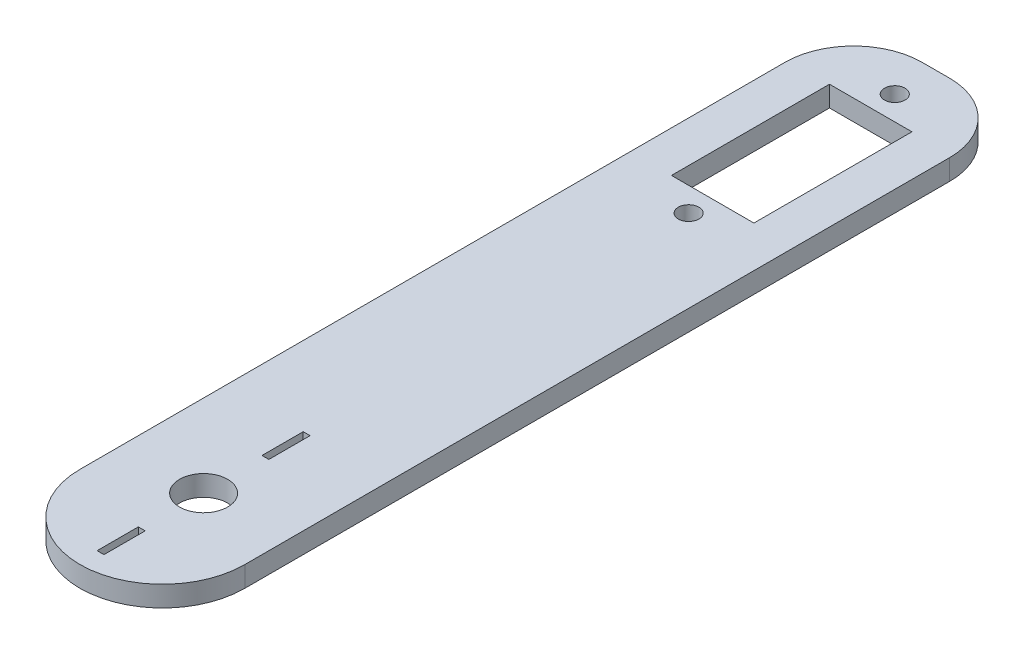
from build123d import *

# Parameters (mm, degrees)
ESBO_O4_R                = 3.5
ESBO_O4_R_2              = 1.5
RESSALTO_EXTRUS_O1_DEPTH = 3


with BuildPart() as part:
    # Esboço4 → Ressalto-extrusão1 (new body)
    with BuildSketch(Plane(origin=(0, 0, 0), x_dir=(1, 0, 0), z_dir=(0, 1, 0))):
        with BuildLine():
            Line((-11.987372598, 93.966613318), (-11.987372598, 71.466613318))
            Line((-11.987372598, 71.466613318), (-11.987372598, -8.633386682))
            ThreePointArc((-11.987372598, -8.633386682), (0.012627402, -20.633386682), (12.012627402, -8.633386682))
            Line((12.012627402, -8.633386682), (12.012627402, 71.466613318))
            Line((12.012627402, 71.466613318), (12.012627402, 93.966613318))
            ThreePointArc((12.012627402, 93.966613318), (9.083695214, 101.03768113), (2.012627402, 103.966613318))
            Line((2.012627402, 103.966613318), (0.012627402, 103.966613318))
            Line((0.012627402, 103.966613318), (-1.987372598, 103.966613318))
            ThreePointArc((-1.987372598, 103.966613318), (-9.05844041, 101.03768113), (-11.987372598, 93.966613318))
        make_face()
        Polygon((0.512627402, -17.633386682), (0.012627402, -17.633386682), (-0.487372598, -17.633386682), (-0.487372598, -11.633386682), (0.512627402, -11.633386682), align=None, mode=Mode.SUBTRACT)
        with Locations(Location((0.012627402, -2.633386682, 0), (0, 0, 270))):
            Circle(ESBO_O4_R, mode=Mode.SUBTRACT)
        Polygon((0.012627402, 12.366613318), (0.512627402, 12.366613318), (0.512627402, 6.366613318), (-0.487372598, 6.366613318), (-0.487372598, 12.366613318), align=None, mode=Mode.SUBTRACT)
        with Locations(Location((0.012627402, 67.966742295, 0), (0, 0, 270))):
            Circle(ESBO_O4_R_2, mode=Mode.SUBTRACT)
        Polygon((6.012627402, 94.466613318), (6.012627402, 71.466613318), (2.487372598, 71.466613318), (-2.487372598, 71.466613318), (-5.987372598, 71.466613318), (-5.987372598, 82.966613318), (-5.987372598, 94.466613318), (-2.5, 94.466613318), (2.5, 94.466613318), align=None, mode=Mode.SUBTRACT)
        with Locations(Location((0.012627402, 97.966613318, 0), (0, 0, 270))):
            Circle(ESBO_O4_R_2, mode=Mode.SUBTRACT)
    extrude(amount=RESSALTO_EXTRUS_O1_DEPTH)


solid = part.part
